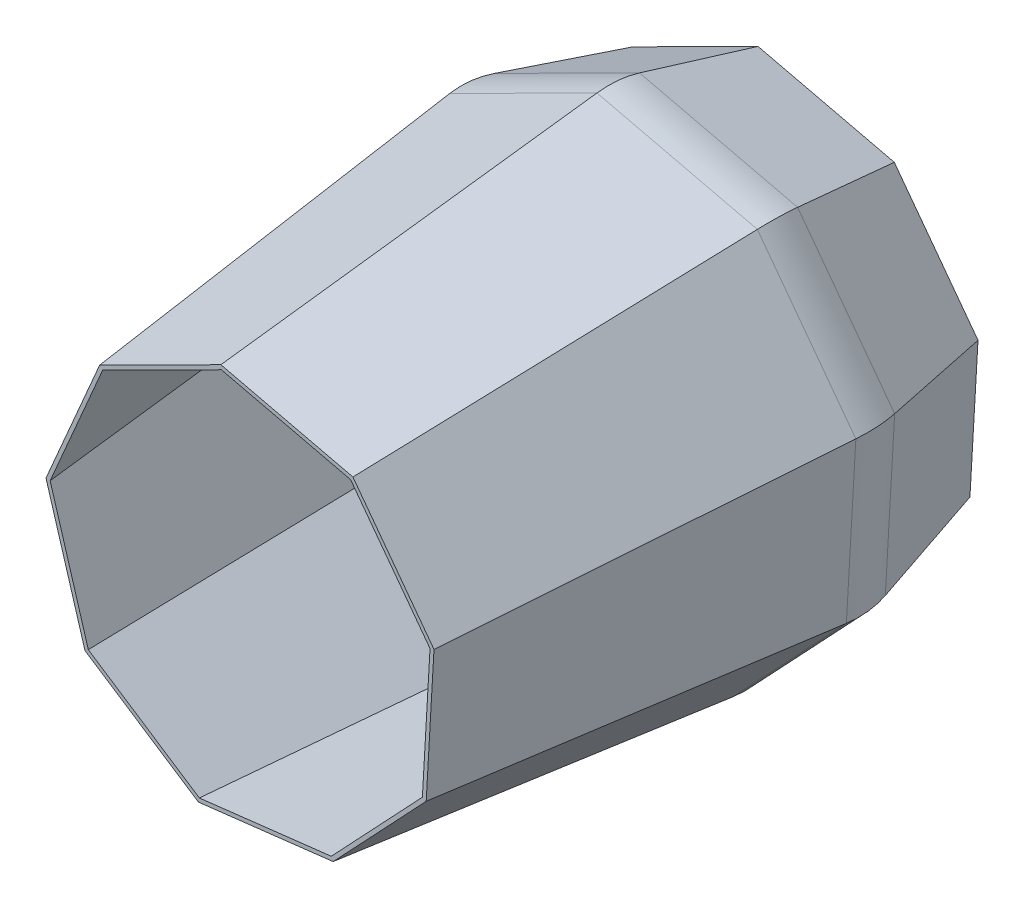
from build123d import *

# Parameters (mm, degrees)
SALIENTE_EXTRUIR4_DEPTH = 35
SALIENTE_EXTRUIR4_DRAFT = -15
SALIENTE_EXTRUIR5_DEPTH = 104
SALIENTE_EXTRUIR5_DRAFT = -6
REDONDEO1_R             = 30
VACIADO1_T              = -1


with BuildPart() as part:
    # Croquis1 → Saliente-Extruir4 (with draft: the straight prism first)
    with BuildSketch(Plane.XY):
        Polygon((23.773844097, -47.265828947), (48.59371037, -20.926193194), (50.676039503, 15.205040923), (29.04648655, 44.221667407), (-6.174240275, 52.546484242), (-38.505971456, 36.284217111), (-52.820330647, 3.04416154), (-42.419470096, -31.620291048), (-12.170068047, -51.489258034), align=None)
    extrude(amount=SALIENTE_EXTRUIR4_DEPTH)
    # Saliente-Extruir4: the draft: its side faces are tilted about the plane it starts from
    saliente_extruir4_sides = [part.faces().sort_by_distance(p)[0] for p in [
        (36.183777233, -34.09601107, 17.5),
        (49.634874936, -2.860576136, 17.5),
        (39.861263027, 29.713354165, 17.5),
        (11.436123138, 48.384075824, 17.5),
        (-22.340105865, 44.415350676, 17.5),
        (-45.663151051, 19.664189326, 17.5),
        (-47.619900371, -14.288064754, 17.5),
        (-27.294769071, -41.554774541, 17.5),
        (5.801888025, -49.37754349, 17.5),
    ]]
    draft(saliente_extruir4_sides, Plane.XY, SALIENTE_EXTRUIR4_DRAFT)


with BuildPart() as saliente_extruir5_tool:
    # Croquis12 → Saliente-Extruir5 (with draft: the straight prism first)
    with BuildSketch(Plane(origin=(0, 0, 35), x_dir=(-1, 0, 0), z_dir=(0, 0, -1))):
        Polygon((50.42110527, -37.584864214), (62.783892537, 3.618385358), (45.76939872, 43.128552207), (7.338894572, 62.458390158), (-34.525559909, 52.563253206), (-60.235121199, 18.073185904), (-57.759999842, -24.873525944), (-28.258332628, -56.181638564), (14.465722479, -61.201738111), align=None)
    extrude(amount=-SALIENTE_EXTRUIR5_DEPTH)
    # Saliente-Extruir5: the draft: its side faces are tilted about the plane it starts from
    saliente_extruir5_sides = [saliente_extruir5_tool.faces().sort_by_distance(p)[0] for p in [
        (-56.602498903, -16.983239428, 87),
        (-54.276645628, 23.373468782, 87),
        (-26.554146646, 52.793471182, 87),
        (13.593332668, 57.510821682, 87),
        (47.380340554, 35.318219555, 87),
        (58.997560521, -3.40017002, 87),
        (43.009166235, -40.527582254, 87),
        (6.896305074, -58.691688337, 87),
        (-32.443413875, -49.393301163, 87),
    ]]
    draft(saliente_extruir5_sides, Plane(origin=(0, 0, 35), x_dir=(-1, 0, 0), z_dir=(0, 0, -1)), SALIENTE_EXTRUIR5_DRAFT)


with BuildPart() as part_1:
    add(part.part)

    # Saliente-Extruir5: add saliente_extruir5_tool
    add(saliente_extruir5_tool.part)

    # Redondeo1
    redondeo1_edges = [part_1.edges().sort_by_distance(p)[0] for p in [
        (13.593332668, 57.510821682, 35),
        (-26.554146646, 52.793471182, 35),
        (-54.276645628, 23.373468782, 35),
        (-56.602498903, -16.983239428, 35),
        (-32.443413875, -49.393301163, 35),
        (6.896305074, -58.691688337, 35),
        (43.009166235, -40.527582254, 35),
        (58.997560521, -3.40017002, 35),
        (47.380340554, 35.318219555, 35),
    ]]
    fillet(redondeo1_edges, radius=REDONDEO1_R)

    # Vaciado1
    vaciado1_openings = [part_1.faces().sort_by_distance(p)[0] for p in [
        (0, 0, 139),
    ]]
    offset(amount=VACIADO1_T, openings=vaciado1_openings)


solid = part_1.part
